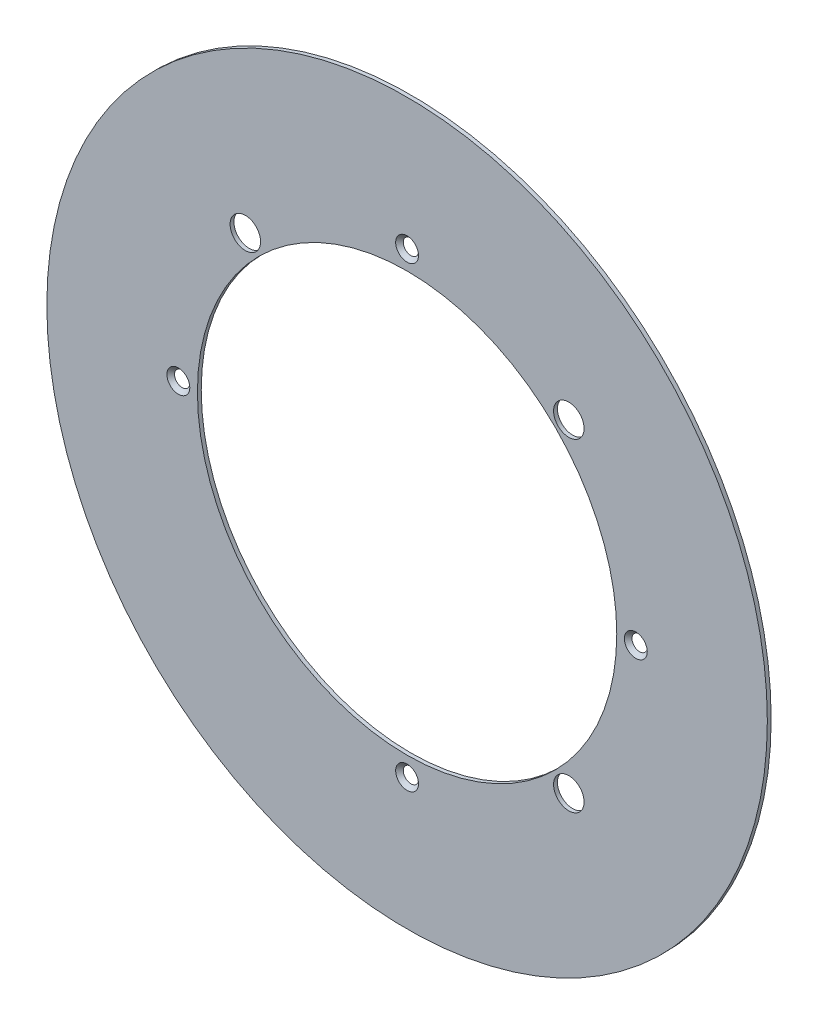
from build123d import *

# Parameters (mm, degrees)
ESQUISSE1_R                                 = 94.5
ESQUISSE1_R_2                               = 55
BOSS_EXTRU_1_DEPTH                          = 1
ENL_V_MAT_EXTRU_2_REACH                     = 135.647
ESQUISSE2_R                                 = 4
FRAISAGE_POUR_VIS_T_TE_FRAIS_E_M31_AT_COUNT = 2
FRAISAGE_POUR_VIS_T_TE_FRAIS_E_M31_AT_PITCH = 84.852813742
FRAISAGE_POUR_VIS_T_TE_FRAIS_E_M31_2_COUNT  = 2
FRAISAGE_POUR_VIS_T_TE_FRAIS_E_M31_2_PITCH  = 120
FRAISAGE_POUR_VIS_T_TE_FRAIS_E_M31_3_COUNT  = 2
FRAISAGE_POUR_VIS_T_TE_FRAIS_E_M31_3_PITCH  = 84.852813742


with BuildPart() as part:
    # Esquisse1 → Boss.-Extru.1 (new body)
    with BuildSketch(Plane.XY):
        Circle(ESQUISSE1_R)
        Circle(ESQUISSE1_R_2, mode=Mode.SUBTRACT)
    extrude(amount=BOSS_EXTRU_1_DEPTH)

    # Esquisse2 → Enlèv. mat.-Extru.2 (cut, up to next)
    with BuildSketch(Plane.XY.offset(1), mode=Mode.PRIVATE) as enl_v_mat_extru_2_sk1:
        with Locations((42.426406871, 42.426406871)):
            Circle(ESQUISSE2_R)
    enl_v_mat_extru_2_tool1 = extrude(enl_v_mat_extru_2_sk1.sketch, amount=-ENL_V_MAT_EXTRU_2_REACH, mode=Mode.PRIVATE) & part.part
    # Esquisse2 → Enlèv. mat.-Extru.2 (cut, up to next)
    with BuildSketch(Plane.XY.offset(1), mode=Mode.PRIVATE) as enl_v_mat_extru_2_sk2:
        with Locations((-42.426406871, 42.426406871)):
            Circle(ESQUISSE2_R)
    enl_v_mat_extru_2_tool2 = extrude(enl_v_mat_extru_2_sk2.sketch, amount=-ENL_V_MAT_EXTRU_2_REACH, mode=Mode.PRIVATE) & part.part
    # Esquisse2 → Enlèv. mat.-Extru.2 (cut, up to next)
    with BuildSketch(Plane.XY.offset(1), mode=Mode.PRIVATE) as enl_v_mat_extru_2_sk3:
        with Locations((42.426406871, -42.426406871)):
            Circle(ESQUISSE2_R)
    enl_v_mat_extru_2_tool3 = extrude(enl_v_mat_extru_2_sk3.sketch, amount=-ENL_V_MAT_EXTRU_2_REACH, mode=Mode.PRIVATE) & part.part
    add(enl_v_mat_extru_2_tool1.solids().sort_by_distance((42.426407, 42.426407, 1))[0], mode=Mode.SUBTRACT)
    add(enl_v_mat_extru_2_tool2.solids().sort_by_distance((-42.426407, 42.426407, 1))[0], mode=Mode.SUBTRACT)
    add(enl_v_mat_extru_2_tool3.solids().sort_by_distance((42.426407, -42.426407, 1))[0], mode=Mode.SUBTRACT)

    # Esquisse3 → Fraisage pour vis à tête fraisée M31 (revolve, cut)
    with BuildSketch(Plane(origin=(0, 60, 1), x_dir=(0, -1, 0), z_dir=(1, 0, 0))):
        Polygon((0, 0), (0, 1), (1.6, 1), (1.6, 1.4), (3, 0), align=None)
    fraisage_pour_vis_t_te_frais_e_m31 = revolve(axis=Axis((0, 60, 7.35), (0, 0, -1)), mode=Mode.SUBTRACT)

    # Fraisage pour vis à tête fraisée M31 at: Fraisage pour vis à tête fraisée M31 ×2
    with Locations(*[Vector(0.7071067811865476, -0.7071067811865476, 0) * (i * FRAISAGE_POUR_VIS_T_TE_FRAIS_E_M31_AT_PITCH) for i in range(1, FRAISAGE_POUR_VIS_T_TE_FRAIS_E_M31_AT_COUNT)]):
        add(fraisage_pour_vis_t_te_frais_e_m31, mode=Mode.SUBTRACT)

    # Fraisage pour vis _ t_te frais_e M31 2: Fraisage pour vis à tête fraisée M31 ×2
    with Locations(*[(0, -i * FRAISAGE_POUR_VIS_T_TE_FRAIS_E_M31_2_PITCH, 0) for i in range(1, FRAISAGE_POUR_VIS_T_TE_FRAIS_E_M31_2_COUNT)]):
        add(fraisage_pour_vis_t_te_frais_e_m31, mode=Mode.SUBTRACT)

    # Fraisage pour vis _ t_te frais_e M31 3: Fraisage pour vis à tête fraisée M31 ×2
    with Locations(*[Vector(-0.7071067811865476, -0.7071067811865476, 0) * (i * FRAISAGE_POUR_VIS_T_TE_FRAIS_E_M31_3_PITCH) for i in range(1, FRAISAGE_POUR_VIS_T_TE_FRAIS_E_M31_3_COUNT)]):
        add(fraisage_pour_vis_t_te_frais_e_m31, mode=Mode.SUBTRACT)


solid = part.part
